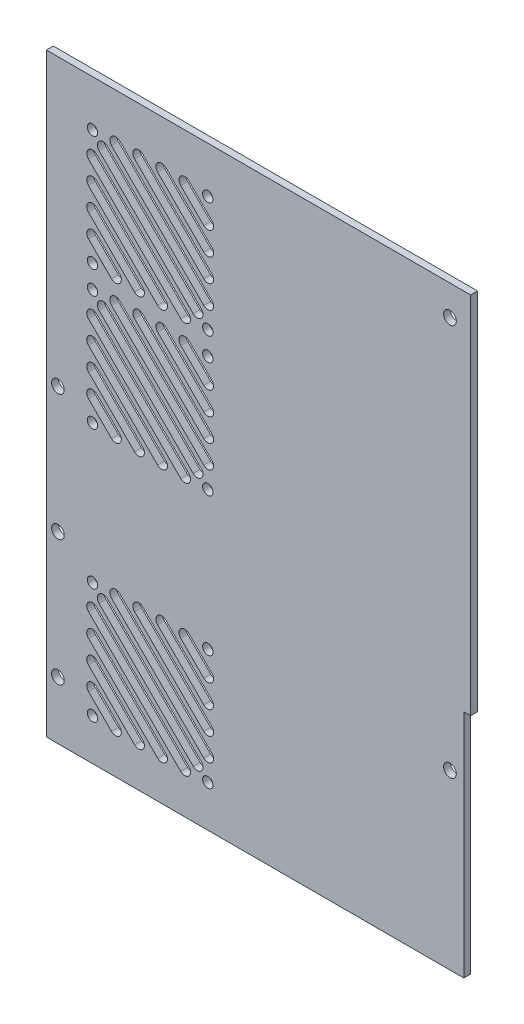
from build123d import *

# Parameters (mm, degrees)
SKETCH1_W            = 184
SKETCH1_H            = 258
BOSS_EXTRUDE1_DEPTH  = 3
M5_CLEARANCE_HOLE1_D = 5.5
CUT_EXTRUDE1_DEPTH   = 10
M4_CLEARANCE_HOLE1_D = 4.5
LPATTERN1_COUNT      = 2
LPATTERN1_PITCH      = 60
LPATTERN2_COUNT      = 2
LPATTERN2_PITCH      = 170
SKETCH7_W            = 3
SKETCH7_H            = 100
CUT_EXTRUDE2_DEPTH   = 10


with BuildPart() as part:
    # Sketch1 → Boss-Extrude1 (new body)
    with BuildSketch(Plane.XY):
        with Locations((92, 129)):
            Rectangle(SKETCH1_W, SKETCH1_H)
    extrude(amount=BOSS_EXTRUDE1_DEPTH)

    # M5 Clearance Hole1 (through all)
    with Locations(Plane(origin=(0, 0, 0), x_dir=(-1, 0, 0), z_dir=(0, 0, -1))):
        with Locations((-175, 75), (-5, 134.225), (-5, 79.6125), (-175, 245), (-5, 25)):
            Hole(M5_CLEARANCE_HOLE1_D / 2)

    # Sketch4 → Cut-Extrude1 (cut)
    with BuildSketch(Plane(origin=(0, 0, 0), x_dir=(-1, 0, 0), z_dir=(0, 0, -1))):
        with BuildLine():
            Line((-61.767766953, 239.767766953), (-71.767766953, 229.767766953))
            ThreePointArc((-71.767766953, 229.767766953), (-71.767766953, 226.232233047), (-68.232233047, 226.232233047))
            Line((-68.232233047, 226.232233047), (-58.232233047, 236.232233047))
            ThreePointArc((-58.232233047, 236.232233047), (-58.232233047, 239.767766953), (-61.767766953, 239.767766953))
        make_face()
        with BuildLine():
            Line((-51.767766953, 239.767766953), (-71.767766953, 219.767766953))
            ThreePointArc((-71.767766953, 219.767766953), (-71.767766953, 216.232233047), (-68.232233047, 216.232233047))
            Line((-68.232233047, 216.232233047), (-48.232233047, 236.232233047))
            ThreePointArc((-48.232233047, 236.232233047), (-48.232233047, 239.767766953), (-51.767766953, 239.767766953))
        make_face()
        with BuildLine():
            Line((-41.767766953, 239.767766953), (-71.767766953, 209.767766953))
            ThreePointArc((-71.767766953, 209.767766953), (-71.767766953, 206.232233047), (-68.232233047, 206.232233047))
            Line((-68.232233047, 206.232233047), (-38.232233047, 236.232233047))
            ThreePointArc((-38.232233047, 236.232233047), (-38.232233047, 239.767766953), (-41.767766953, 239.767766953))
        make_face()
        with BuildLine():
            Line((-31.767766953, 239.767766953), (-71.767766953, 199.767766953))
            ThreePointArc((-71.767766953, 199.767766953), (-71.767766953, 196.232233047), (-68.232233047, 196.232233047))
            Line((-68.232233047, 196.232233047), (-28.232233047, 236.232233047))
            ThreePointArc((-28.232233047, 236.232233047), (-28.232233047, 239.767766953), (-31.767766953, 239.767766953))
        make_face()
        with BuildLine():
            ThreePointArc((-22.828427125, 231.636038969), (-22.828427125, 235.171572875), (-26.363961031, 235.171572875))
            Line((-26.363961031, 235.171572875), (-67.171572875, 194.363961031))
            ThreePointArc((-67.171572875, 194.363961031), (-67.171572875, 190.828427125), (-63.636038969, 190.828427125))
            Line((-63.636038969, 190.828427125), (-22.828427125, 231.636038969))
        make_face()
        with BuildLine():
            Line((-21.767766953, 229.767766953), (-61.767766953, 189.767766953))
            ThreePointArc((-61.767766953, 189.767766953), (-61.767766953, 186.232233047), (-58.232233047, 186.232233047))
            Line((-58.232233047, 186.232233047), (-18.232233047, 226.232233047))
            ThreePointArc((-18.232233047, 226.232233047), (-18.232233047, 229.767766953), (-21.767766953, 229.767766953))
        make_face()
        with BuildLine():
            Line((-48.232233047, 186.232233047), (-18.232233047, 216.232233047))
            ThreePointArc((-18.232233047, 216.232233047), (-18.232233047, 219.767766953), (-21.767766953, 219.767766953))
            Line((-21.767766953, 219.767766953), (-51.767766953, 189.767766953))
            ThreePointArc((-51.767766953, 189.767766953), (-51.767766953, 186.232233047), (-48.232233047, 186.232233047))
        make_face()
        with BuildLine():
            Line((-21.767766953, 209.767766953), (-41.767766953, 189.767766953))
            ThreePointArc((-41.767766953, 189.767766953), (-41.767766953, 186.232233047), (-38.232233047, 186.232233047))
            Line((-38.232233047, 186.232233047), (-18.232233047, 206.232233047))
            ThreePointArc((-18.232233047, 206.232233047), (-18.232233047, 209.767766953), (-21.767766953, 209.767766953))
        make_face()
        with BuildLine():
            Line((-21.767766953, 199.767766953), (-31.767766953, 189.767766953))
            ThreePointArc((-31.767766953, 189.767766953), (-31.767766953, 186.232233047), (-28.232233047, 186.232233047))
            Line((-28.232233047, 186.232233047), (-18.232233047, 196.232233047))
            ThreePointArc((-18.232233047, 196.232233047), (-18.232233047, 199.767766953), (-21.767766953, 199.767766953))
        make_face()
    cut_extrude1 = extrude(amount=-CUT_EXTRUDE1_DEPTH, mode=Mode.SUBTRACT)

    # M4 Clearance Hole1 (through all)
    with Locations(Plane(origin=(0, 0, 0), x_dir=(-1, 0, 0), z_dir=(0, 0, -1))):
        with Locations((-20, 188), (-70, 188), (-70, 238), (-20, 238)):
            m4_clearance_hole1 = Hole(M4_CLEARANCE_HOLE1_D / 2)

    # LPattern1: Cut-Extrude1, M4 Clearance Hole1 ×2
    with Locations(*[(0, -i * LPATTERN1_PITCH, 0) for i in range(1, LPATTERN1_COUNT)]):
        add(cut_extrude1, mode=Mode.SUBTRACT)
        add(m4_clearance_hole1, mode=Mode.SUBTRACT)

    # LPattern2: Cut-Extrude1, M4 Clearance Hole1 ×2
    with Locations(*[(0, -i * LPATTERN2_PITCH, 0) for i in range(1, LPATTERN2_COUNT)]):
        add(cut_extrude1, mode=Mode.SUBTRACT)
        add(m4_clearance_hole1, mode=Mode.SUBTRACT)

    # Sketch7 → Cut-Extrude2 (cut)
    with BuildSketch(Plane(origin=(0, 0, 0), x_dir=(-1, 0, 0), z_dir=(0, 0, -1))):
        with Locations((-182.5, 50)):
            Rectangle(SKETCH7_W, SKETCH7_H)
    extrude(amount=-CUT_EXTRUDE2_DEPTH, mode=Mode.SUBTRACT)


solid = part.part
